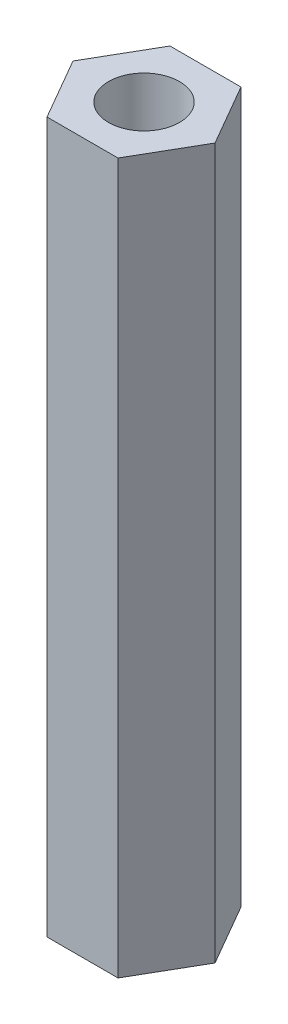
from build123d import *

# Parameters (mm, degrees)
SKETCH1_R           = 1.5
BOSS_EXTRUDE1_DEPTH = 30


with BuildPart() as part:
    # Sketch1 → Boss-Extrude1 (new body)
    with BuildSketch(Plane(origin=(0, 0, 0), x_dir=(1, 0, 0), z_dir=(0, 1, 0))):
        Polygon((-1.5, -2.598076211), (1.5, -2.598076211), (3, 0), (1.5, 2.598076211), (-1.5, 2.598076211), (-3, 0), align=None)
        with Locations(Location((0, 0, 0), (0, 0, 270))):
            Circle(SKETCH1_R, mode=Mode.SUBTRACT)
    extrude(amount=BOSS_EXTRUDE1_DEPTH)


solid = part.part
